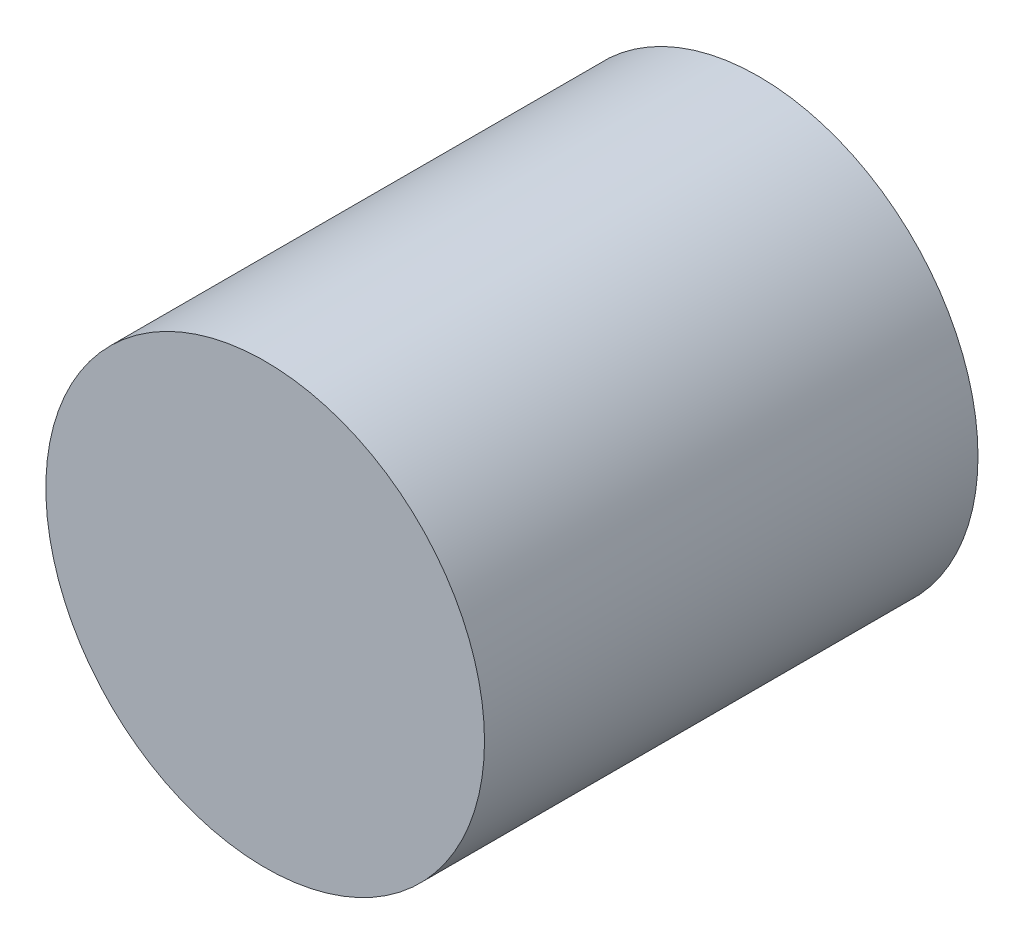
from build123d import *

# Parameters (mm, degrees)
SKETCH1_R      = 20
EXTRUDE1_DEPTH = 45


with BuildPart() as part:
    # Sketch1 → Extrude1 (new body)
    with BuildSketch(Plane.XY):
        with Locations((425, -70)):
            Circle(SKETCH1_R)
    extrude(amount=-EXTRUDE1_DEPTH)


solid = part.part
